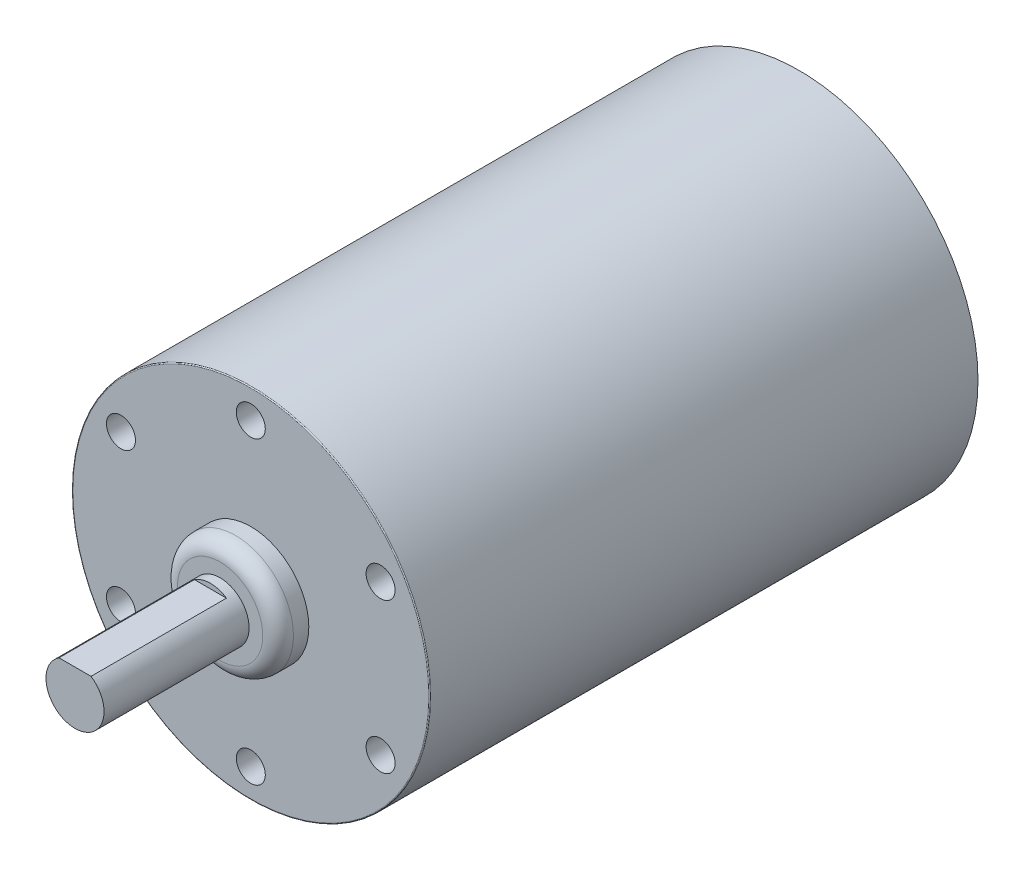
from build123d import *

# Parameters (mm, degrees)
SKETCH1_R           = 18.5
BOSS_EXTRUDE1_DEPTH = 56.6928
FILLET3_R           = 0.1
SKETCH2_R           = 6
BOSS_EXTRUDE2_DEPTH = 3.175
FILLET2_R           = 1.5875
SKETCH5_R           = 3
BOSS_EXTRUDE3_DEPTH = 15
CUT_EXTRUDE1_START  = -14
CUT_EXTRUDE1_DEPTH  = 14
SKETCH7_R           = 1.5
CUT_EXTRUDE2_DEPTH  = 10


with BuildPart() as part:
    # Sketch1 → Boss-Extrude1 (new body)
    with BuildSketch(Plane.XY):
        Circle(SKETCH1_R)
    extrude(amount=BOSS_EXTRUDE1_DEPTH)

    # Fillet3
    fillet3_edges = [part.edges().sort_by_distance(p)[0] for p in [
        (-18.5, 0, 56.6928),
    ]]
    fillet(fillet3_edges, radius=FILLET3_R)

    # Sketch2 → Boss-Extrude2 (add)
    with BuildSketch(Plane.XY.offset(56.6928)):
        Circle(SKETCH2_R)
    extrude(amount=BOSS_EXTRUDE2_DEPTH)

    # Fillet2
    fillet2_edges = [part.edges().sort_by_distance(p)[0] for p in [
        (-6, 0, 59.8678),
    ]]
    fillet(fillet2_edges, radius=FILLET2_R)

    # Sketch5 → Boss-Extrude3 (add)
    with BuildSketch(Plane.XY.offset(59.8678)):
        Circle(SKETCH5_R)
    extrude(amount=BOSS_EXTRUDE3_DEPTH)

    # Sketch6 → Cut-Extrude1 (cut)
    with BuildSketch(Plane.XY.offset(74.8678).offset(CUT_EXTRUDE1_START)):
        with BuildLine():
            Line((-1.658312395, 2.5), (1.658312395, 2.5))
            ThreePointArc((1.658312395, 2.5), (0, 3), (-1.658312395, 2.5))
        make_face()
    extrude(amount=CUT_EXTRUDE1_DEPTH, mode=Mode.SUBTRACT)

    # Sketch7 → Cut-Extrude2 (cut)
    with BuildSketch(Plane.XY.offset(56.6928)):
        with Locations((0, 15.5)):
            Circle(SKETCH7_R)
        with Locations((13.423393759, 7.75)):
            Circle(SKETCH7_R)
        with Locations((13.423393759, -7.75)):
            Circle(SKETCH7_R)
        with Locations((0, -15.5)):
            Circle(SKETCH7_R)
        with Locations((-13.423393759, -7.75)):
            Circle(SKETCH7_R)
        with Locations((-13.423393759, 7.75)):
            Circle(SKETCH7_R)
    extrude(amount=-CUT_EXTRUDE2_DEPTH, mode=Mode.SUBTRACT)


solid = part.part
